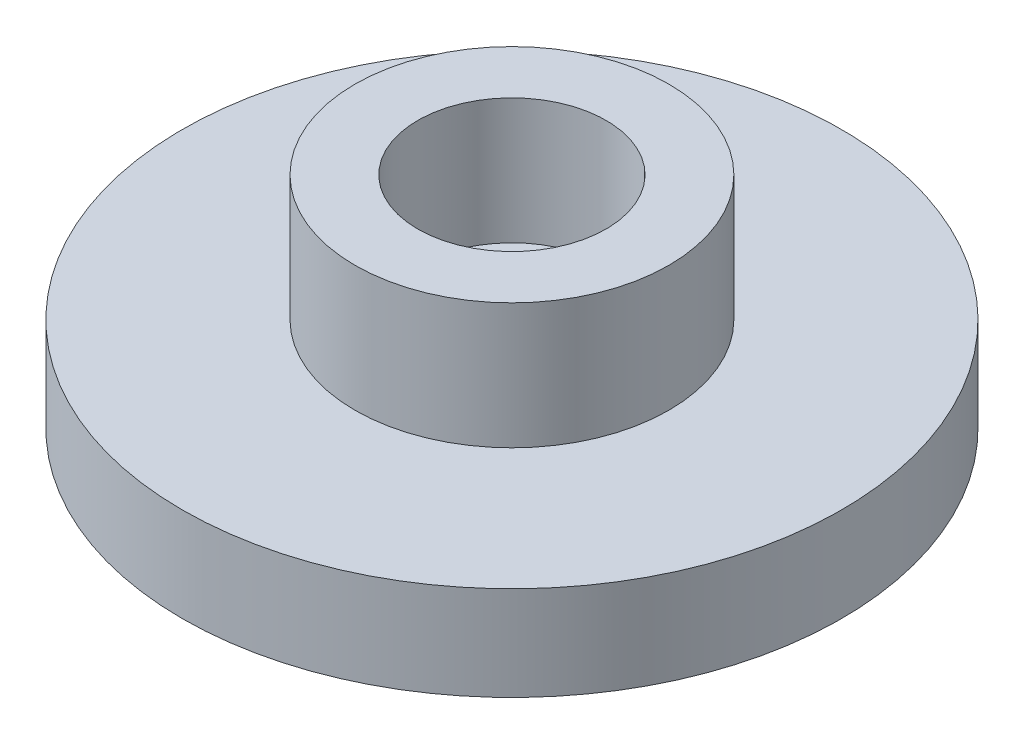
from build123d import *

# Parameters (mm, degrees)
SKETCH1_R           = 10.5
BOSS_EXTRUDE1_DEPTH = 3
SKETCH2_R           = 5
BOSS_EXTRUDE2_DEPTH = 4
SKETCH3_R           = 3
CUT_EXTRUDE1_DEPTH  = 4


with BuildPart() as part:
    # Sketch1 → Boss-Extrude1 (new body)
    with BuildSketch(Plane(origin=(0, 0, 0), x_dir=(1, 0, 0), z_dir=(0, 1, 0))):
        with Locations(Location((0, 0, 0), (0, 0, 270))):
            Circle(SKETCH1_R)
    extrude(amount=BOSS_EXTRUDE1_DEPTH)

    # Sketch2 → Boss-Extrude2 (add)
    with BuildSketch(Plane(origin=(0, 3, 0), x_dir=(1, 0, 0), z_dir=(0, 1, 0))):
        with Locations(Location((0, 0, 0), (0, 0, 270))):
            Circle(SKETCH2_R)
    extrude(amount=BOSS_EXTRUDE2_DEPTH)

    # Sketch3 → Cut-Extrude1 (cut)
    with BuildSketch(Plane(origin=(0, 7, 0), x_dir=(1, 0, 0), z_dir=(0, 1, 0))):
        with Locations(Location((0, 0, 0), (0, 0, 270))):
            Circle(SKETCH3_R)
    extrude(amount=-CUT_EXTRUDE1_DEPTH, mode=Mode.SUBTRACT)


solid = part.part
